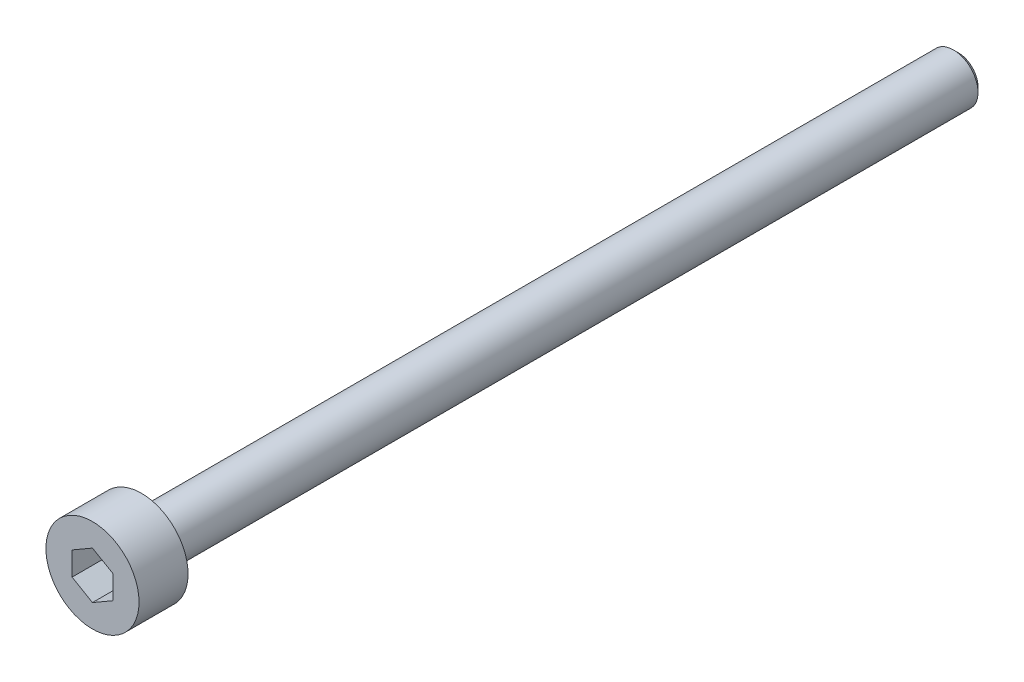
from build123d import *

# Parameters (mm, degrees)
SKETCH1_R           = 2.85
BOSS_EXTRUDE1_DEPTH = 3
SKETCH2_R           = 1.5
BOSS_EXTRUDE2_DEPTH = 50
CHAMFER1_SIZE       = 0.3
CUT_EXTRUDE1_DEPTH  = 2


with BuildPart() as part:
    # Sketch1 → Boss-Extrude1 (new body)
    with BuildSketch(Plane.XY):
        Circle(SKETCH1_R)
    extrude(amount=BOSS_EXTRUDE1_DEPTH)

    # Sketch2 → Boss-Extrude2 (add)
    with BuildSketch(Plane(origin=(0, 0, 0), x_dir=(-1, 0, 0), z_dir=(0, 0, -1))):
        with Locations(Location((0, 0, 0), (0, 0, 180))):
            Circle(SKETCH2_R)
    extrude(amount=BOSS_EXTRUDE2_DEPTH)

    # Chamfer1
    chamfer1_edges = [part.edges().sort_by_distance(p)[0] for p in [
        (-1.5, 0, -50),
    ]]
    chamfer(chamfer1_edges, length=CHAMFER1_SIZE)

    # Sketch3 → Cut-Extrude1 (cut)
    with BuildSketch(Plane.XY.offset(3)):
        Polygon((0, 1.443375673), (-1.25, 0.721687836), (-1.25, -0.721687836), (0, -1.443375673), (1.25, -0.721687836), (1.25, 0.721687836), align=None)
    extrude(amount=-CUT_EXTRUDE1_DEPTH, mode=Mode.SUBTRACT)


solid = part.part
